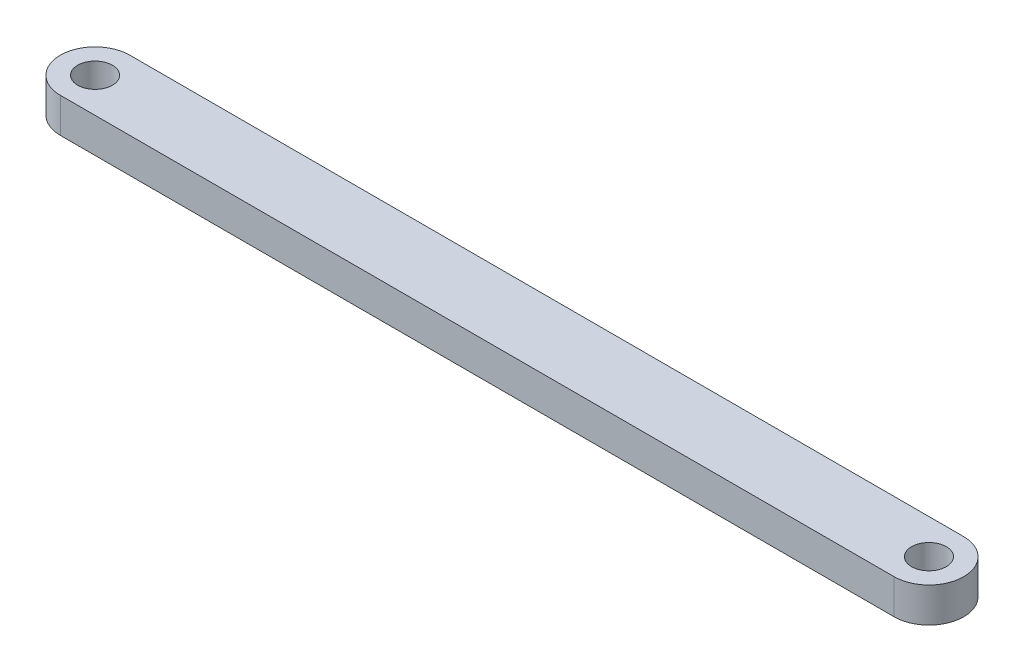
from build123d import *

# Parameters (mm, degrees)
SKETCH1_R           = 2.5
BOSS_EXTRUDE1_DEPTH = 5


with BuildPart() as part:
    # Sketch1 → Boss-Extrude1 (new body)
    with BuildSketch(Plane(origin=(0, 0, 0), x_dir=(1, 0, 0), z_dir=(0, 1, 0))):
        with BuildLine():
            Line((60, -5), (-60, -5))
            ThreePointArc((-60, -5), (-65, 0), (-60, 5))
            Line((-60, 5), (60, 5))
            ThreePointArc((60, 5), (65, 0), (60, -5))
        make_face()
        with Locations(Location((-60, 0, 0), (0, 0, 270))):
            Circle(SKETCH1_R, mode=Mode.SUBTRACT)
        with Locations(Location((60, 0, 0), (0, 0, 270))):
            Circle(SKETCH1_R, mode=Mode.SUBTRACT)
    extrude(amount=BOSS_EXTRUDE1_DEPTH)


solid = part.part
